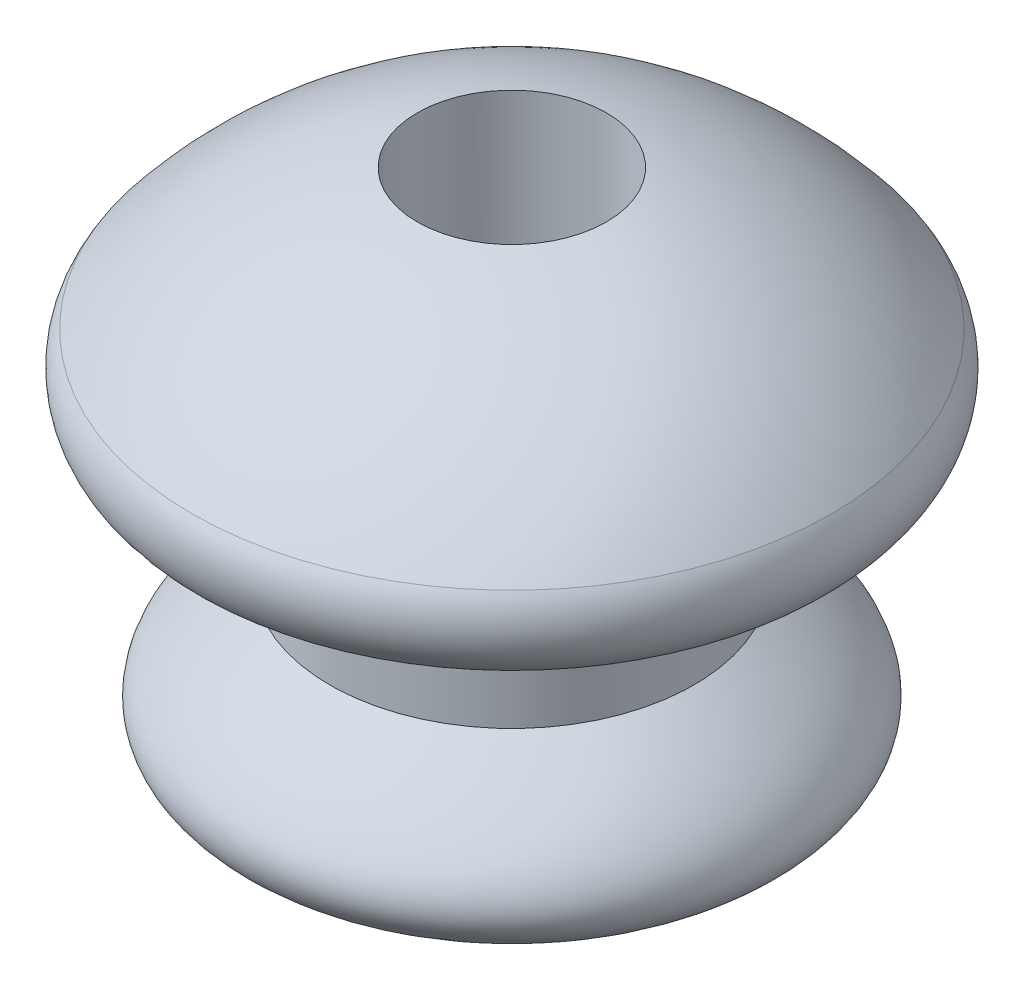
from build123d import *

# Parameters (mm, degrees)
SKETCH2_R          = 1
CUT_EXTRUDE2_DEPTH = 8.659830556


with BuildPart() as part:
    # Sketch1 → Revolve1 (revolve)
    with BuildSketch(Plane.XY, mode=Mode.PRIVATE) as revolve1_sk:
        with BuildLine():
            add(Edge.make_bspline(
                [(1.901469747, -4.187890833), (3.997803393, -5.505352851), (2.40138715, -6.003675185), (0.316595481, -6.158045679)],
                knots=[0, 0, 0, 0, 1, 1, 1, 1], degree=3))
            Line((1.901469747, -4.187890833), (1.901469747, -2.687890833))
            Line((1.901469747, -2.687890833), (3.270835138, -2.687890833))
            ThreePointArc((3.270835138, -2.687890833), (3.457066196, -2.306019715), (3.356353959, -1.893267243))
            ThreePointArc((3.356353959, -1.893267243), (3.314000681, -1.841444099), (3.270835138, -1.790295548))
            ThreePointArc((3.270835138, -1.790295548), (1.788504548, -0.681920638), (-0.024669059, -0.310167514))
            Line((-0.024669059, -0.310167514), (-0.024669059, -6.158045679))
            Line((-0.024669059, -6.158045679), (0.316595481, -6.158045679))
        make_face()
    revolve(revolve1_sk.sketch.rotate(Axis((-0.024669059, -4.1454e-05, 0), (0, -1, 0)), 180), axis=Axis((-0.024669059, -4.1454e-05, 0), (0, -1, 0)))

    # Sketch2 → Cut-Extrude2 (cut, through all)
    with BuildSketch(Plane(origin=(0, -6.158045679, 0), x_dir=(-1, 0, 0), z_dir=(0, -1, 0))):
        with Locations((0.024669059, 0)):
            Circle(SKETCH2_R)
    extrude(amount=-CUT_EXTRUDE2_DEPTH, mode=Mode.SUBTRACT)


solid = part.part
